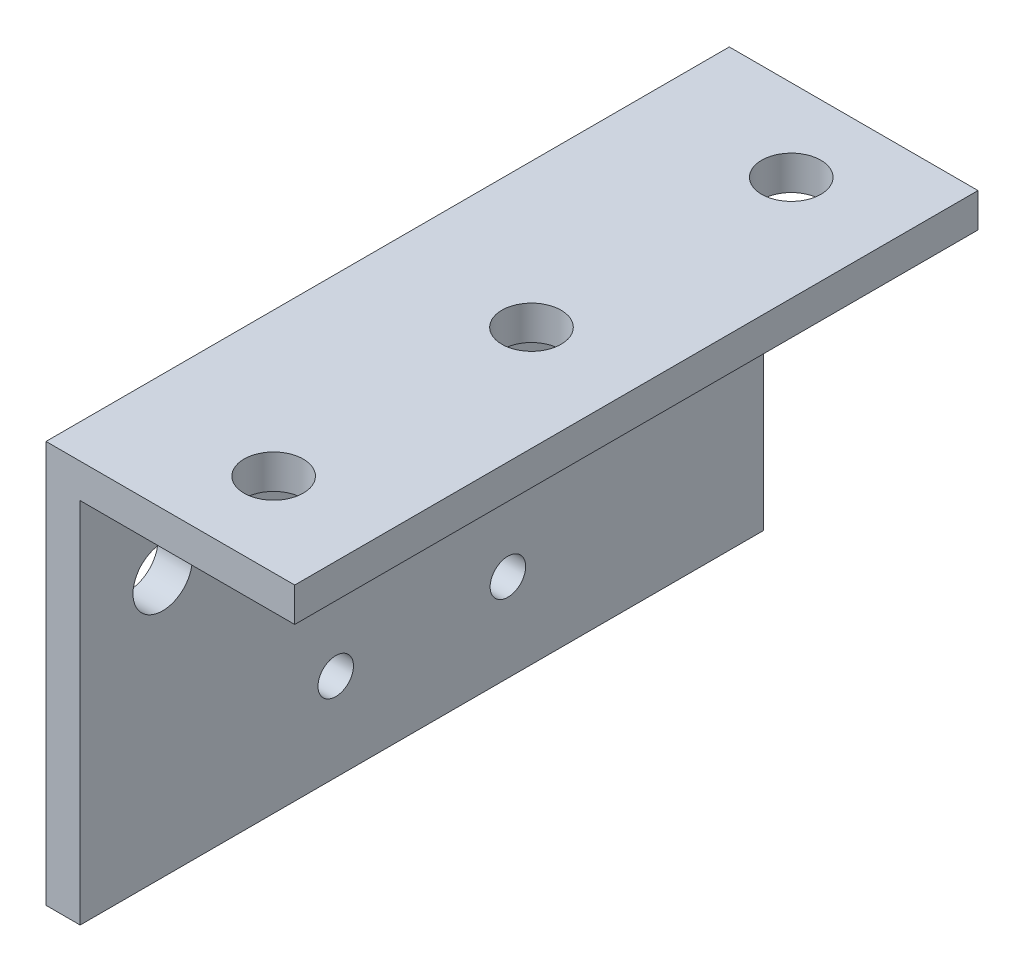
from build123d import *

# Parameters (mm, degrees)
BOSS_EXTRUDE1_DEPTH         = 63.5
M5_CLEARANCE_HOLE1_D        = 5.5
M5_CLEARANCE_HOLE2_D        = 5.5
M5_CLEARANCE_HOLE3_D        = 5.5
M5_CLEARANCE_HOLE4_D        = 5.5
M5_CLEARANCE_HOLE5_D        = 5.5
TAP_DRILL_FOR_M4X0_7_TAP2_D = 3.3


with BuildPart() as part:
    # Sketch1 → Boss-Extrude1 (new body)
    with BuildSketch(Plane.XY):
        Polygon((0, 0), (0, 37.338), (23.114, 37.338), (23.114, 34.163), (3.175, 34.163), (3.175, 0), align=None)
    extrude(amount=BOSS_EXTRUDE1_DEPTH)

    # M5 Clearance Hole1 (through all)
    with Locations(Plane.ZY):
        with Locations((55.84134748, 24.208221519)):
            Hole(M5_CLEARANCE_HOLE1_D / 2)

    # M5 Clearance Hole2 (through all)
    with Locations(Plane.ZY):
        with Locations((7.677638483, 24.208221519)):
            Hole(M5_CLEARANCE_HOLE2_D / 2)

    # M5 Clearance Hole3 (through all)
    with Locations(Plane(origin=(0, 37.338, 0), x_dir=(1, 0, 0), z_dir=(0, 1, 0))):
        with Locations((13.368582087, -31.75)):
            Hole(M5_CLEARANCE_HOLE3_D / 2)

    # M5 Clearance Hole4 (through all)
    with Locations(Plane(origin=(0, 37.338, 0), x_dir=(1, 0, 0), z_dir=(0, 1, 0))):
        with Locations((13.368582087, -55.713693276)):
            Hole(M5_CLEARANCE_HOLE4_D / 2)

    # M5 Clearance Hole5 (through all)
    with Locations(Plane(origin=(0, 37.338, 0), x_dir=(1, 0, 0), z_dir=(0, 1, 0))):
        with Locations((13.368582087, -7.610649616)):
            Hole(M5_CLEARANCE_HOLE5_D / 2)

    # Tap Drill for M4x0.7 Tap2 (through all)
    with Locations(Plane.ZY):
        with Locations((23.75, 24.163), (23.75, 8.163), (39.75, 8.163), (39.75, 24.163)):
            Hole(TAP_DRILL_FOR_M4X0_7_TAP2_D / 2)


solid = part.part
